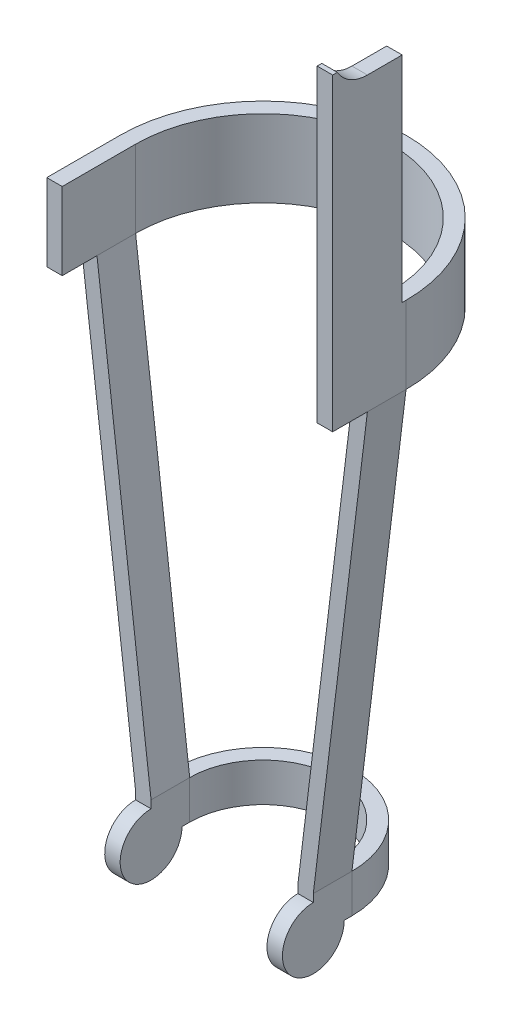
from build123d import *

# Parameters (mm, degrees)
EXTRUDE_1_DEPTH     = 20
SKETCH_3_R          = 16
EXTRUDE_2_DEPTH     = 8
EXTRUDE_START       = -8
SKETCH_4_R          = 16
EXTRUDE_3_DEPTH     = 8
EXTRUDE_4_DEPTH     = 20
SKETCH_5_W          = 8
SKETCH_5_H          = 20
SKETCH_7_W          = 8
SKETCH_7_H          = 20
SKETCH_10_W         = 8
SKETCH_10_H         = 36
EXTRUDE_5_DEPTH     = 160
CUT_EXTRUDE_3_DEPTH = 160
SKETCH_13_W         = 62.199259601
SKETCH_13_H         = 136.537597085
CUT_EXTRUDE_4_DEPTH = 10


with BuildPart() as part:
    # 草图2 → 凸台-拉伸1 (new body)
    with BuildSketch(Plane(origin=(0, 0, 0), x_dir=(1, 0, 0), z_dir=(0, 1, 0))):
        with BuildLine():
            Line((-46, 0), (-46, -20))
            Line((-46, -20), (-38, -20))
            Line((-38, -20), (-38, 0))
            ThreePointArc((-38, 0), (0, 38), (38, 0))
            Line((38, 0), (38, -20))
            Line((38, -20), (46, -20))
            Line((46, -20), (46, 0))
            ThreePointArc((46, 0), (0, 46), (-46, 0))
        make_face()
    extrude(amount=EXTRUDE_1_DEPTH)

    # 草图3 → 凸台-拉伸2 (add)
    with BuildSketch(Plane.ZY.offset(46)):
        with Locations((20, 0)):
            Circle(SKETCH_3_R)
    extrude(amount=-EXTRUDE_2_DEPTH)

    # 草图4 → 凸台-拉伸3 (add)
    with BuildSketch(Plane(origin=(46, 0, 0), x_dir=(0, 0, -1), z_dir=(1, 0, 0)).offset(EXTRUDE_START)):
        with Locations((-20, 0)):
            Circle(SKETCH_4_R)
    extrude(amount=EXTRUDE_3_DEPTH)



with BuildPart() as body_2:
    # Sketch 3D_1 → 凸台-拉伸4 (new, symmetric)
    with BuildSketch(Plane(origin=(-74, 270, 0), x_dir=(0.9909924304103234, 0, 0.13391789600139506), z_dir=(0, -1, 0))):
        with BuildLine():
            Line((0, 0), (2.67835792, 19.819848608))
            Line((2.67835792, 19.819848608), (10.606297363, 18.74850544))
            Line((10.606297363, 18.74850544), (7.927939443, -1.071343168))
            ThreePointArc((7.927939443, -1.071343168), (64.494858714, -75.315424711), (138.738940257, -18.74850544))
            Line((138.738940257, -18.74850544), (141.417298177, 1.071343168))
            Line((141.417298177, 1.071343168), (149.345237621, 0))
            Line((149.345237621, 0), (146.666879701, -19.819848608))
            ThreePointArc((146.666879701, -19.819848608), (63.423515546, -83.243364154), (0, 0))
        make_face()
    extrude(amount=EXTRUDE_4_DEPTH, both=True)


with BuildPart() as part_1:
    add(part.part)

    add(body_2.part)  # 扫描1 merges body 2
    # 扫描1: sweep along a path in 草图6
    with BuildLine(Plane.XY.offset(20)) as sweep_1_path:
        Line((46, 20), (74, 250))
    # 草图5 → 扫描1 (sweep)
    with BuildSketch(Plane(origin=(0, 20, 0), x_dir=(1, 0, 0), z_dir=(0, 1, 0))):
        with Locations((42, -10)):
            Rectangle(SKETCH_5_W, SKETCH_5_H)
    sweep(path=sweep_1_path.line)

    # 扫描2: sweep along a path in 草图8
    with BuildLine(Plane.XY.offset(20)) as sweep_2_path:
        Line((-46, 20), (-74, 250))
    # 草图7 → 扫描2 (sweep)
    with BuildSketch(Plane(origin=(0, 20, 0), x_dir=(1, 0, 0), z_dir=(0, 1, 0))):
        with Locations((-42, -10)):
            Rectangle(SKETCH_7_W, SKETCH_7_H)
    sweep(path=sweep_2_path.line)

    # 草图10 → 凸台-拉伸5 (add)
    with BuildSketch(Plane.XZ.offset(-250)):
        with Locations((-70, 20)):
            Rectangle(SKETCH_10_W, SKETCH_10_H)
        with Locations((70, 20)):
            Rectangle(SKETCH_10_W, SKETCH_10_H)
    extrude(amount=-EXTRUDE_5_DEPTH)

    # 草图12 → 切除-拉伸3 (cut)
    with BuildSketch(Plane.ZY.offset(74)):
        with BuildLine():
            Line((20, 401), (2, 401))
            Line((2, 401), (2, 419))
            ThreePointArc((2, 419), (32.727922061, 431.727922061), (20, 401))
        make_face()
    extrude(amount=-CUT_EXTRUDE_3_DEPTH, mode=Mode.SUBTRACT)

    # 草图13 → 切除-拉伸4 (cut)
    with BuildSketch(Plane.ZY.offset(74)):
        with Locations((25.303398621, 358.268798543)):
            Rectangle(SKETCH_13_W, SKETCH_13_H)
    extrude(amount=-CUT_EXTRUDE_4_DEPTH, mode=Mode.SUBTRACT)


solid = part_1.part
